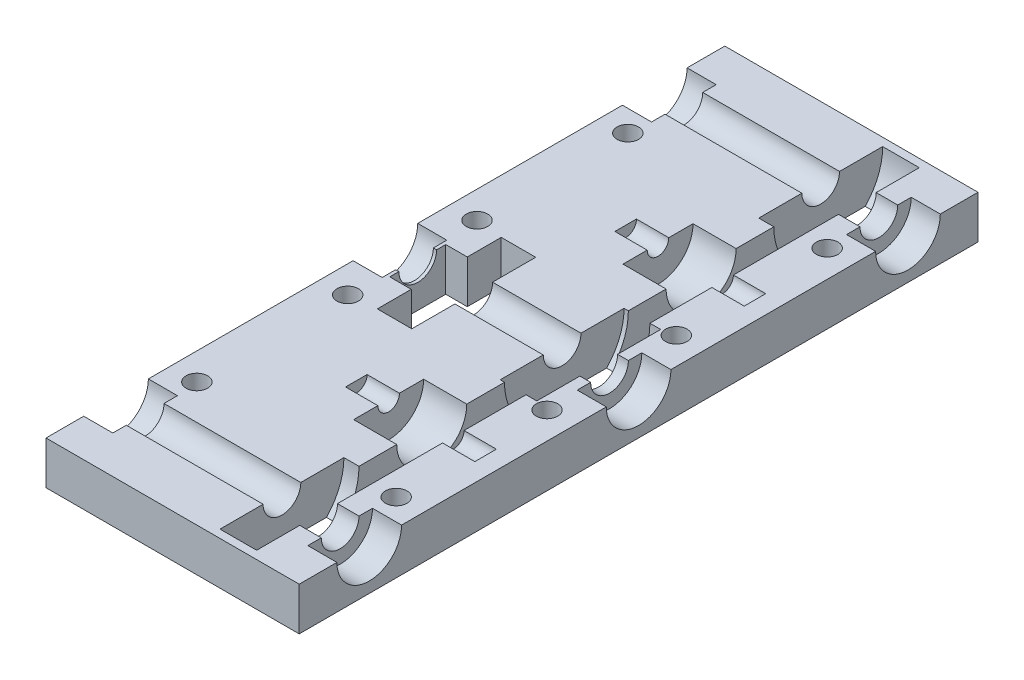
from build123d import *

# Parameters (mm, degrees)
SKETCH_4_W           = 23.5
SKETCH_4_H           = 63
EXTRUDE_1_DEPTH      = 7
SKETCH_5_R           = 1.75
CUT_EXTRUDE_1_DEPTH  = 40.918667312
SKETCH_5_3_R         = 3
CUT_EXTRUDE_4_DEPTH  = 2.7
CUT_EXTRUDE_START    = -20.8
SKETCH_5_4_R         = 3
CUT_EXTRUDE_5_DEPTH  = 2.7
SKETCH_5_5_R         = 3
CUT_EXTRUDE_6_DEPTH  = 2.7
SKETCH_5_6_R         = 3
CUT_EXTRUDE_7_DEPTH  = 2.7
SKETCH_6_R           = 1.5
SKETCH_6_R_2         = 1
CUT_EXTRUDE_2_DEPTH  = 5
SKETCH_6_2_R         = 1
CUT_EXTRUDE_3_DEPTH  = 35.341119667
CUT_EXTRUDE_8_DEPTH  = 6
CUT_EXTRUDE_START_2  = -1
SKETCH_12_R          = 5.75
CUT_EXTRUDE_9_DEPTH  = 3.4
CUT_EXTRUDE_START_3  = 0.4
SKETCH_13_R          = 8.25
CUT_EXTRUDE_10_DEPTH = 2
SKETCH_14_R          = 3.25
CUT_EXTRUDE_11_DEPTH = 4
CUT_EXTRUDE_START_4  = -4.7
SKETCH_15_R          = 1
CUT_EXTRUDE_12_DEPTH = 3
CUT_EXTRUDE_START_5  = -13.7
SKETCH_15_2_R        = 1
CUT_EXTRUDE_15_DEPTH = 3
SKETCH_16_R          = 5.75
CUT_EXTRUDE_13_DEPTH = 3.4
SKETCH_17_W          = 23.5
SKETCH_17_H          = 63
CUT_EXTRUDE_14_DEPTH = 3


with BuildPart() as part:
    # 草图4 → 凸台-拉伸1 (new body)
    with BuildSketch(Plane(origin=(0, 0, 0), x_dir=(1, 0, 0), z_dir=(0, 1, 0))):
        Rectangle(SKETCH_4_W, SKETCH_4_H)
    extrude(amount=EXTRUDE_1_DEPTH)

    # 草图5 → 切除-拉伸1 (cut, through all)
    with BuildSketch(Plane(origin=(11.75, 0, 0), x_dir=(0, 0, -1), z_dir=(1, 0, 0))):
        with Locations((-25, 7)):
            Circle(SKETCH_5_R)
        with Locations((0, 7)):
            Circle(SKETCH_5_R)
        with Locations((25, 7)):
            Circle(SKETCH_5_R)
    extrude(amount=-CUT_EXTRUDE_1_DEPTH, mode=Mode.SUBTRACT)

    # 草图5<3> → 切除-拉伸4 (cut)
    with BuildSketch(Plane(origin=(11.75, 0, 0), x_dir=(0, 0, -1), z_dir=(1, 0, 0))):
        with Locations((-25, 7)):
            Circle(SKETCH_5_3_R)
        with Locations((25, 7)):
            Circle(SKETCH_5_3_R)
    extrude(amount=-CUT_EXTRUDE_4_DEPTH, mode=Mode.SUBTRACT)

    # 草图5<4> → 切除-拉伸5 (cut)
    with BuildSketch(Plane(origin=(11.75, 0, 0), x_dir=(0, 0, -1), z_dir=(1, 0, 0)).offset(CUT_EXTRUDE_START)):
        with Locations((-25, 7)):
            Circle(SKETCH_5_4_R)
        with Locations((25, 7)):
            Circle(SKETCH_5_4_R)
    extrude(amount=-CUT_EXTRUDE_5_DEPTH, mode=Mode.SUBTRACT)

    # 草图5<5> → 切除-拉伸6 (cut)
    with BuildSketch(Plane(origin=(11.75, 0, 0), x_dir=(0, 0, -1), z_dir=(1, 0, 0))):
        with Locations((0, 7)):
            Circle(SKETCH_5_5_R)
    extrude(amount=-CUT_EXTRUDE_6_DEPTH, mode=Mode.SUBTRACT)

    # 草图5<6> → 切除-拉伸7 (cut)
    with BuildSketch(Plane(origin=(11.75, 0, 0), x_dir=(0, 0, -1), z_dir=(1, 0, 0)).offset(CUT_EXTRUDE_START)):
        with Locations((0, 7)):
            Circle(SKETCH_5_6_R)
    extrude(amount=-CUT_EXTRUDE_7_DEPTH, mode=Mode.SUBTRACT)

    # 草图6 → 切除-拉伸2 (cut)
    # profile 1 of 8: a face of its own
    with BuildSketch(Plane.XZ):
        with Locations(Location((-9.25, 6, 0), (0, 0, 270))):
            Circle(SKETCH_6_R)
        with Locations(Location((-9.25, 6, 0), (0, 0, 270))):
            Circle(SKETCH_6_R_2, mode=Mode.SUBTRACT)
    # profile 2 of 8: a face of its own
    with BuildSketch(Plane.XZ):
        with Locations(Location((9.25, 6, 0), (0, 0, 270))):
            Circle(SKETCH_6_R)
        with Locations(Location((9.25, 6, 0), (0, 0, 270))):
            Circle(SKETCH_6_R_2, mode=Mode.SUBTRACT)
    # profile 3 of 8: a face of its own
    with BuildSketch(Plane.XZ):
        with Locations(Location((-9.25, -20, 0), (0, 0, 270))):
            Circle(SKETCH_6_R)
        with Locations(Location((-9.25, -20, 0), (0, 0, 270))):
            Circle(SKETCH_6_R_2, mode=Mode.SUBTRACT)
    # profile 4 of 8: a face of its own
    with BuildSketch(Plane.XZ):
        with Locations(Location((9.25, -20, 0), (0, 0, 270))):
            Circle(SKETCH_6_R)
        with Locations(Location((9.25, -20, 0), (0, 0, 270))):
            Circle(SKETCH_6_R_2, mode=Mode.SUBTRACT)
    # profile 5 of 8: a face of its own
    with BuildSketch(Plane.XZ):
        with Locations(Location((-9.25, 20, 0), (0, 0, 270))):
            Circle(SKETCH_6_R)
        with Locations(Location((-9.25, 20, 0), (0, 0, 270))):
            Circle(SKETCH_6_R_2, mode=Mode.SUBTRACT)
    # profile 6 of 8: a face of its own
    with BuildSketch(Plane.XZ):
        with Locations(Location((9.25, 20, 0), (0, 0, 270))):
            Circle(SKETCH_6_R)
        with Locations(Location((9.25, 20, 0), (0, 0, 270))):
            Circle(SKETCH_6_R_2, mode=Mode.SUBTRACT)
    # profile 7 of 8: a face of its own
    with BuildSketch(Plane.XZ):
        with Locations(Location((-9.25, -6, 0), (0, 0, 270))):
            Circle(SKETCH_6_R)
        with Locations(Location((-9.25, -6, 0), (0, 0, 270))):
            Circle(SKETCH_6_R_2, mode=Mode.SUBTRACT)
    # profile 8 of 8: a face of its own
    with BuildSketch(Plane.XZ):
        with Locations(Location((9.25, -6, 0), (0, 0, 270))):
            Circle(SKETCH_6_R)
        with Locations(Location((9.25, -6, 0), (0, 0, 270))):
            Circle(SKETCH_6_R_2, mode=Mode.SUBTRACT)
    extrude(amount=-CUT_EXTRUDE_2_DEPTH, mode=Mode.SUBTRACT)

    # 草图6<2> → 切除-拉伸3 (cut, through all)
    with BuildSketch(Plane.XZ):
        with Locations(Location((-9.25, -20, 0), (0, 0, 270))):
            Circle(SKETCH_6_2_R)
        with Locations(Location((9.25, -20, 0), (0, 0, 270))):
            Circle(SKETCH_6_2_R)
        with Locations(Location((-9.25, 20, 0), (0, 0, 270))):
            Circle(SKETCH_6_2_R)
        with Locations(Location((9.25, 20, 0), (0, 0, 270))):
            Circle(SKETCH_6_2_R)
        with Locations(Location((9.25, -6, 0), (0, 0, 270))):
            Circle(SKETCH_6_2_R)
        with Locations(Location((-9.25, -6, 0), (0, 0, 270))):
            Circle(SKETCH_6_2_R)
        with Locations(Location((-9.25, 6, 0), (0, 0, 270))):
            Circle(SKETCH_6_2_R)
        with Locations(Location((9.25, 6, 0), (0, 0, 270))):
            Circle(SKETCH_6_2_R)
    extrude(amount=-CUT_EXTRUDE_3_DEPTH, mode=Mode.SUBTRACT)

    # 草图10 → 切除-拉伸8 (cut)
    with BuildSketch(Plane(origin=(0, 7, 0), x_dir=(1, 0, 0), z_dir=(0, 1, 0))):
        Polygon((-8.75, 2.6), (-8.75, -2.6), (-6.75, -2.6), (-6.75, -5.75), (-3.55, -5.75), (-3.55, 5.75), (-6.75, 5.75), (-6.75, 2.6), align=None)
    extrude(amount=-CUT_EXTRUDE_8_DEPTH, mode=Mode.SUBTRACT)

    # 草图12 → 切除-拉伸9 (cut)
    with BuildSketch(Plane(origin=(9.05, 0, 0), x_dir=(0, 0, -1), z_dir=(1, 0, 0)).offset(CUT_EXTRUDE_START_2)):
        with Locations((0, 7)):
            Circle(SKETCH_12_R)
    extrude(amount=-CUT_EXTRUDE_9_DEPTH, mode=Mode.SUBTRACT)

    # 草图13 → 切除-拉伸10 (cut)
    with BuildSketch(Plane(origin=(4.65, 0, 0), x_dir=(0, 0, -1), z_dir=(1, 0, 0)).offset(CUT_EXTRUDE_START_3)):
        with Locations((-12.5, 7)):
            Circle(SKETCH_13_R)
        with Locations((12.5, 7)):
            Circle(SKETCH_13_R)
    extrude(amount=CUT_EXTRUDE_10_DEPTH, mode=Mode.SUBTRACT)

    # 草图14 → 切除-拉伸11 (cut)
    with BuildSketch(Plane(origin=(5.05, 0, 0), x_dir=(0, 0, -1), z_dir=(1, 0, 0))):
        with Locations((-12.5, 7)):
            Circle(SKETCH_14_R)
        with Locations((12.5, 7)):
            Circle(SKETCH_14_R)
    extrude(amount=-CUT_EXTRUDE_11_DEPTH, mode=Mode.SUBTRACT)

    # 草图15 → 切除-拉伸12 (cut)
    with BuildSketch(Plane(origin=(11.75, 0, 0), x_dir=(0, 0, -1), z_dir=(1, 0, 0)).offset(CUT_EXTRUDE_START_4)):
        with Locations((-12.5, 7)):
            Circle(SKETCH_15_R)
        with Locations((12.5, 7)):
            Circle(SKETCH_15_R)
    extrude(amount=CUT_EXTRUDE_12_DEPTH, mode=Mode.SUBTRACT)

    # 草图15<2> → 切除-拉伸15 (cut)
    with BuildSketch(Plane(origin=(11.75, 0, 0), x_dir=(0, 0, -1), z_dir=(1, 0, 0)).offset(CUT_EXTRUDE_START_5)):
        with Locations((-12.5, 7)):
            Circle(SKETCH_15_2_R)
        with Locations((12.5, 7)):
            Circle(SKETCH_15_2_R)
    extrude(amount=CUT_EXTRUDE_15_DEPTH, mode=Mode.SUBTRACT)

    # 草图16 → 切除-拉伸13 (cut)
    with BuildSketch(Plane.ZY.offset(-7.05)):
        with Locations((25, 7)):
            Circle(SKETCH_16_R)
        with Locations((-25, 7)):
            Circle(SKETCH_16_R)
    extrude(amount=CUT_EXTRUDE_13_DEPTH, mode=Mode.SUBTRACT)

    # 草图17 → 切除-拉伸14 (cut)
    with BuildSketch(Plane.XZ):
        Rectangle(SKETCH_17_W, SKETCH_17_H)
    extrude(amount=-CUT_EXTRUDE_14_DEPTH, mode=Mode.SUBTRACT)


solid = part.part
